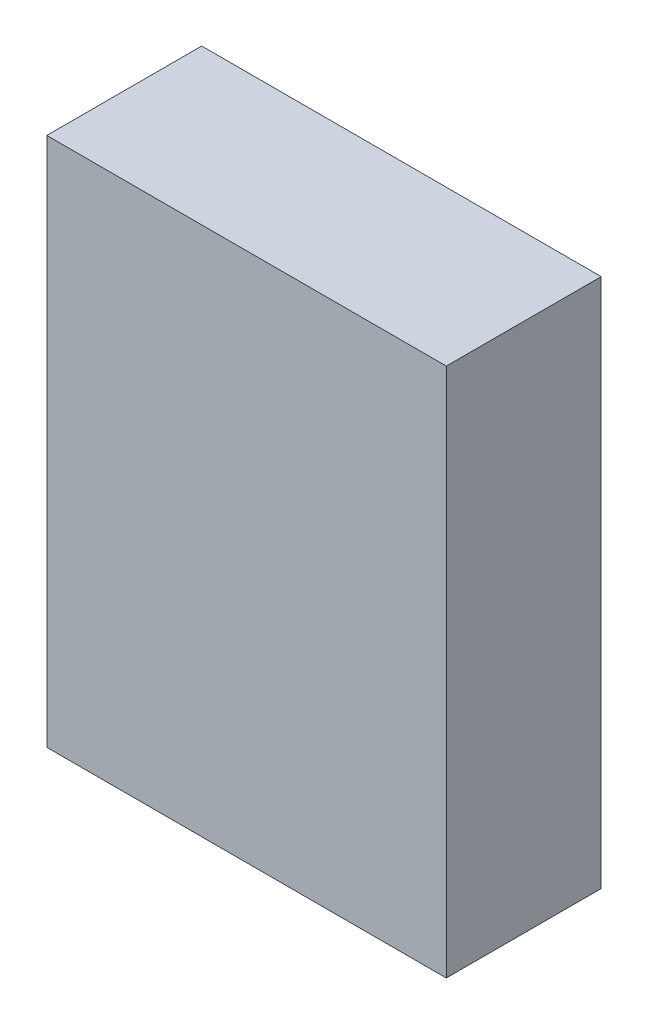
from build123d import *

# Parameters (mm, degrees)
SKETCH1_W           = 98
SKETCH1_H           = 38
BOSS_EXTRUDE1_DEPTH = 130


with BuildPart() as part:
    # Sketch1 → Boss-Extrude1 (new body)
    with BuildSketch(Plane(origin=(0, 0, 0), x_dir=(1, 0, 0), z_dir=(0, 1, 0))):
        Rectangle(SKETCH1_W, SKETCH1_H)
    extrude(amount=BOSS_EXTRUDE1_DEPTH)


solid = part.part
